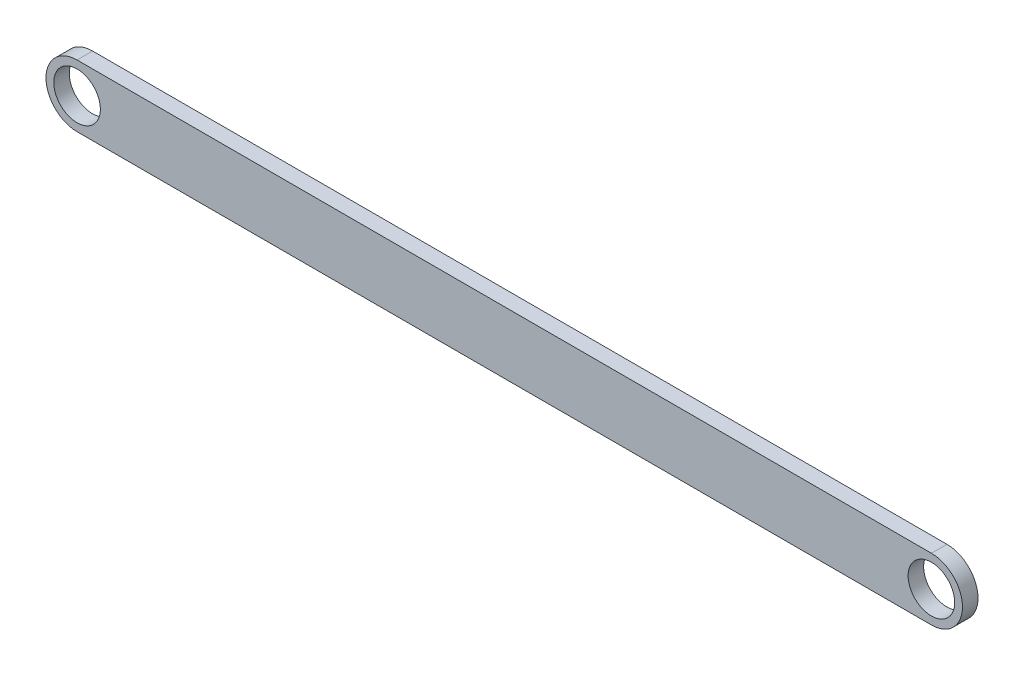
from build123d import *

# Parameters (mm, degrees)
SKETCH_1_R      = 15
EXTRUDE_3_DEPTH = 10


with BuildPart() as part:
    # Эскиз1 → Бобышка-Вытянуть3 (new body)
    with BuildSketch(Plane.XY):
        with BuildLine():
            Line((0, 20), (550, 20))
            ThreePointArc((550, 20), (570, 0), (550, -20))
            Line((550, -20), (0, -20))
            ThreePointArc((0, -20), (-20, 0), (0, 20))
        make_face()
        Circle(SKETCH_1_R, mode=Mode.SUBTRACT)
        with Locations((550, 0)):
            Circle(SKETCH_1_R, mode=Mode.SUBTRACT)
    extrude(amount=EXTRUDE_3_DEPTH)


solid = part.part
